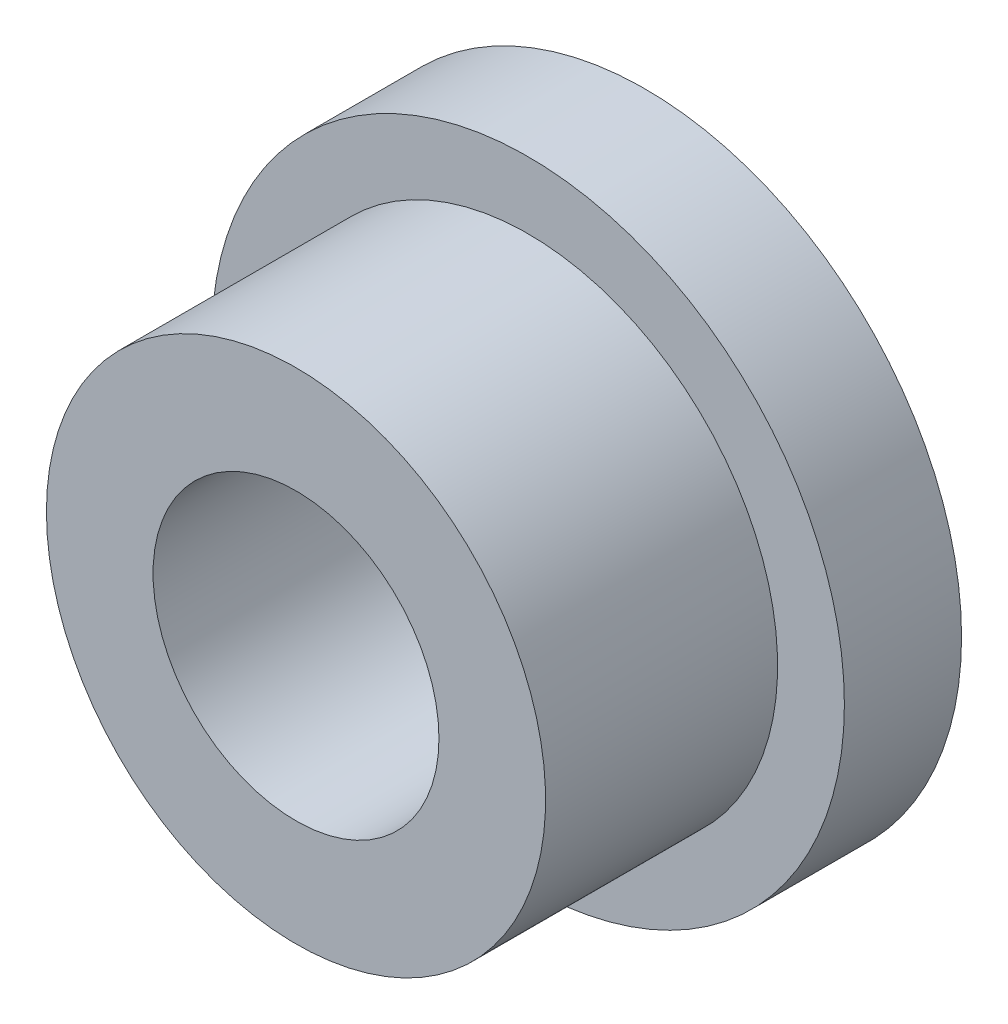
from build123d import *

# Parameters (mm, degrees)
SKETCH1_R           = 13.5
BOSS_EXTRUDE1_DEPTH = 5
SKETCH2_R           = 10.65
BOSS_EXTRUDE2_DEPTH = 9.9
SKETCH5_R           = 6.1
CUT_EXTRUDE1_DEPTH  = 10


with BuildPart() as part:
    # Sketch1 → Boss-Extrude1 (new body)
    with BuildSketch(Plane.XY):
        Circle(SKETCH1_R)
    extrude(amount=BOSS_EXTRUDE1_DEPTH)

    # Sketch2 → Boss-Extrude2 (add)
    with BuildSketch(Plane.XY.offset(5)):
        with Locations(Location((0, 0, 0), (0, 0, 180))):
            Circle(SKETCH2_R)
    extrude(amount=BOSS_EXTRUDE2_DEPTH)

    # Sketch5 → Cut-Extrude1 (cut)
    with BuildSketch(Plane.XY.offset(5)):
        Circle(SKETCH5_R)
    extrude(amount=CUT_EXTRUDE1_DEPTH, mode=Mode.SUBTRACT)


solid = part.part
